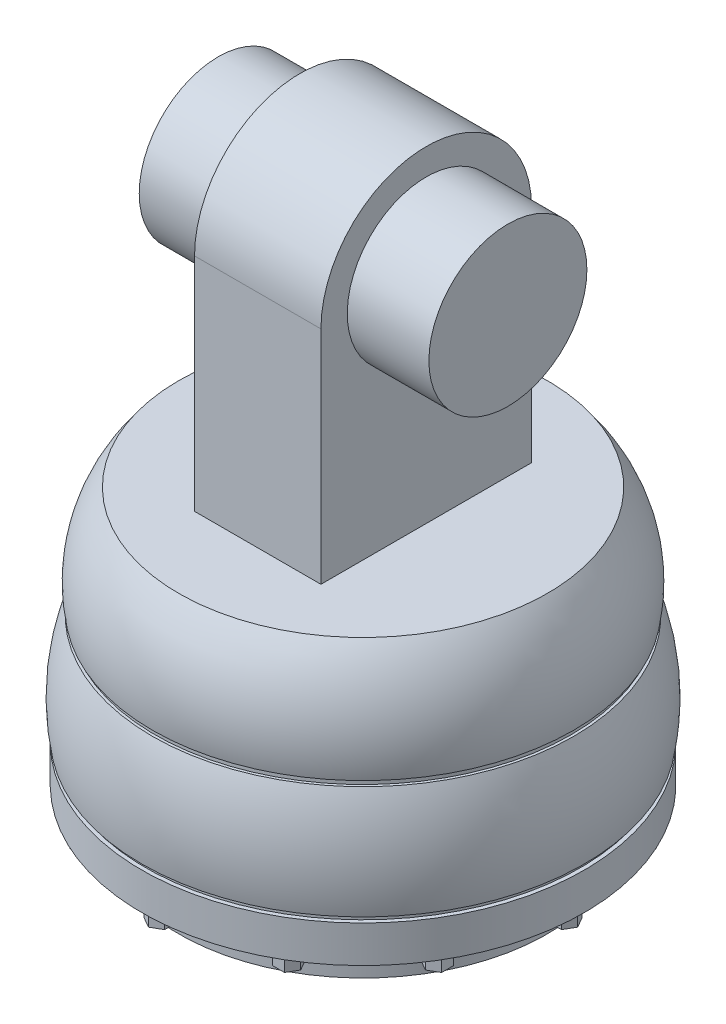
from build123d import *

# Parameters (mm, degrees)
SKETCH2_R            = 39.5
BOSS_EXTRUDE1_DEPTH  = 1
SKETCH4_R            = 41.25
BOSS_EXTRUDE2_DEPTH  = 1
SKETCH5_R            = 42
BOSS_EXTRUDE3_DEPTH  = 7
SKETCH6_R            = 35
BOSS_EXTRUDE4_DEPTH  = 7
BOSS_EXTRUDE7_DEPTH  = 3
CIRPATTERN2_COUNT    = 12
SKETCH8_R            = 15
BOSS_EXTRUDE8_DEPTH  = 10
SKETCH9_W            = 24
SKETCH9_H            = 40
BOSS_EXTRUDE9_DEPTH  = 42
BOSS_EXTRUDE10_START = -24
BOSS_EXTRUDE10_DEPTH = 24
SKETCH11_R           = 15
BOSS_EXTRUDE11_DEPTH = 15.5
BOSS_EXTRUDE12_START = 15.5
SKETCH12_R           = 15
BOSS_EXTRUDE12_DEPTH = 15.5


with BuildPart() as part:
    # Sketch1 → Revolve1 (revolve)
    with BuildSketch(Plane.XY):
        with BuildLine():
            Line((0, 0), (-35, 0))
            ThreePointArc((-35, 0), (-39.657515479, -9.46062113), (-40, -20))
            Line((-40, -20), (0, -20))
            Line((0, -20), (0, 0))
        make_face()
    revolve(axis=Axis((0, 0, 0), (0, -1, 0)))

    # Sketch2 → Boss-Extrude1 (add)
    with BuildSketch(Plane.XZ.offset(20)):
        Circle(SKETCH2_R)
    extrude(amount=BOSS_EXTRUDE1_DEPTH)

    # Sketch3 → Revolve2 (revolve)
    with BuildSketch(Plane(origin=(0, 0, 0), x_dir=(0, 0, -1), z_dir=(1, 0, 0)), mode=Mode.PRIVATE) as revolve2_sk:
        with BuildLine():
            Line((0, -21), (-40, -21))
            ThreePointArc((-40, -21), (-42.384109041, -30.861589096), (-42, -41))
            Line((-42, -41), (0, -41))
            Line((0, -41), (0, -21))
        make_face()
    revolve(revolve2_sk.sketch.rotate(Axis((0, -21, 0), (0, -1, 0)), 90), axis=Axis((0, -21, 0), (0, -1, 0)))

    # Sketch4 → Boss-Extrude2 (add)
    with BuildSketch(Plane.XZ.offset(41)):
        with Locations(Location((0, 0, 0), (0, 0, 270))):
            Circle(SKETCH4_R)
    extrude(amount=BOSS_EXTRUDE2_DEPTH)

    # Sketch5 → Boss-Extrude3 (add)
    with BuildSketch(Plane.XZ.offset(42)):
        with Locations(Location((0, 0, 0), (0, 0, 270))):
            Circle(SKETCH5_R)
    extrude(amount=BOSS_EXTRUDE3_DEPTH)

    # Sketch6 → Boss-Extrude4 (add)
    with BuildSketch(Plane.XZ.offset(49)):
        with Locations(Location((0, 0, 0), (0, 0, 270))):
            Circle(SKETCH6_R)
    extrude(amount=BOSS_EXTRUDE4_DEPTH)

    # Sketch7 → Boss-Extrude7 (add)
    with BuildSketch(Plane.XZ.offset(49)):
        Polygon((40.75, 0), (39.625, 1.948557159), (37.375, 1.948557159), (36.25, 0), (37.375, -1.948557159), (39.625, -1.948557159), align=None)
        Polygon((39.047649731, 0.948557159), (37.952350269, 0.948557159), (37.404700538, 0), (37.952350269, -0.948557159), (39.047649731, -0.948557159), (39.595299462, 0), align=None, mode=Mode.SUBTRACT)
    boss_extrude7 = extrude(amount=BOSS_EXTRUDE7_DEPTH)

    # CirPattern2: Boss-Extrude7 ×12 about axis
    cirpattern2_axis = Axis((0, 0, 0), (0, 1, 0))
    for i in range(1, CIRPATTERN2_COUNT):
        add(boss_extrude7.rotate(cirpattern2_axis, i * 360 / CIRPATTERN2_COUNT))

    # Sketch8 → Boss-Extrude8 (add)
    with BuildSketch(Plane.XZ.offset(56)):
        with Locations(Location((0, 0, 0), (0, 0, 270))):
            Circle(SKETCH8_R)
    extrude(amount=BOSS_EXTRUDE8_DEPTH)

    # Sketch9 → Boss-Extrude9 (add)
    with BuildSketch(Plane(origin=(0, 0, 0), x_dir=(1, 0, 0), z_dir=(0, 1, 0))):
        Rectangle(SKETCH9_W, SKETCH9_H)
    extrude(amount=BOSS_EXTRUDE9_DEPTH)

    # Sketch10 → Boss-Extrude10 (add)
    with BuildSketch(Plane.ZY.offset(12).offset(BOSS_EXTRUDE10_START)):
        with BuildLine():
            Line((-20, 42), (20, 42))
            ThreePointArc((20, 42), (0, 62), (-20, 42))
        make_face()
    extrude(amount=BOSS_EXTRUDE10_DEPTH)

    # Sketch11 → Boss-Extrude11 (add)
    with BuildSketch(Plane.ZY.offset(12)):
        with Locations(Location((0, 42, 0), (0, 0, 90))):
            Circle(SKETCH11_R)
    extrude(amount=BOSS_EXTRUDE11_DEPTH)

    # Sketch12 → Boss-Extrude12 (add)
    with BuildSketch(Plane(origin=(12, 0, 0), x_dir=(0, 0, -1), z_dir=(1, 0, 0)).offset(BOSS_EXTRUDE12_START)):
        with Locations(Location((0, 42, 0), (0, 0, 90))):
            Circle(SKETCH12_R)
    extrude(amount=-BOSS_EXTRUDE12_DEPTH)


solid = part.part
